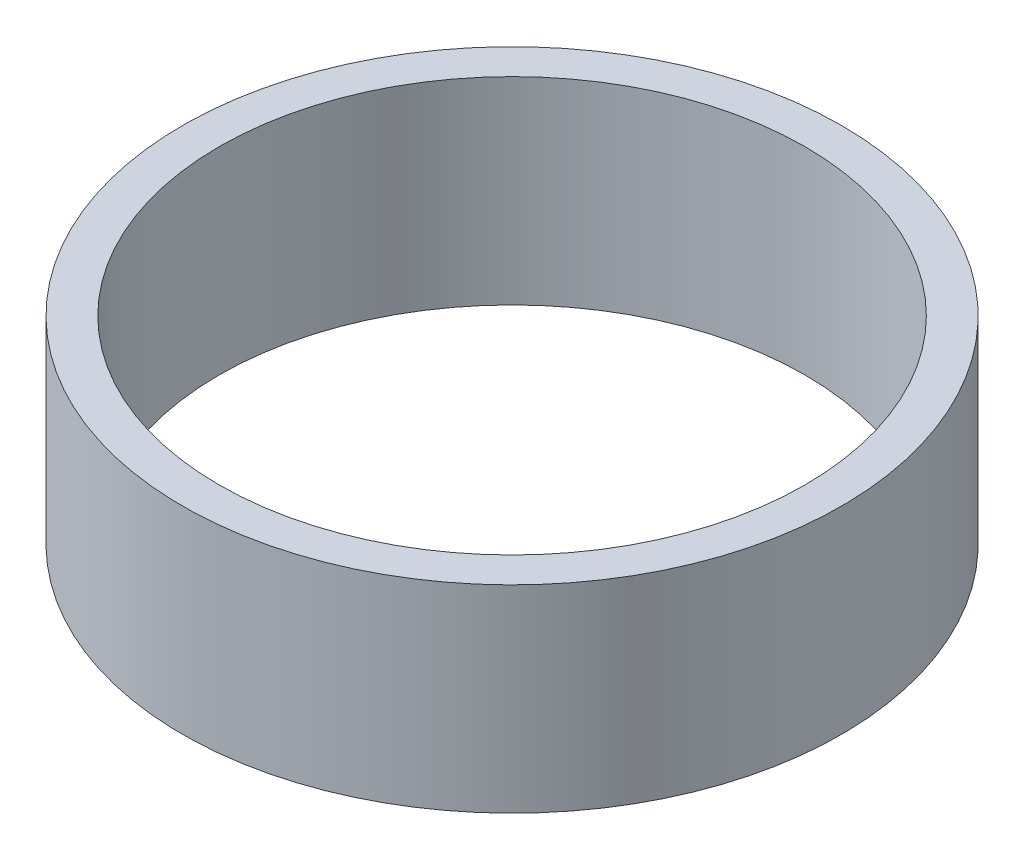
from build123d import *

# Parameters (mm, degrees)
SKETCH1_W = 1.5875
SKETCH1_H = 8.5725


with BuildPart() as part:
    # Sketch1 → Revolve1 (revolve)
    with BuildSketch(Plane(origin=(0, 0, 0), x_dir=(0, 0, -1), z_dir=(1, 0, 0))):
        with Locations((13.49375, 4.28625)):
            Rectangle(SKETCH1_W, SKETCH1_H)
    revolve(axis=Axis((0, 0, 0), (0, 1, 0)))


solid = part.part
